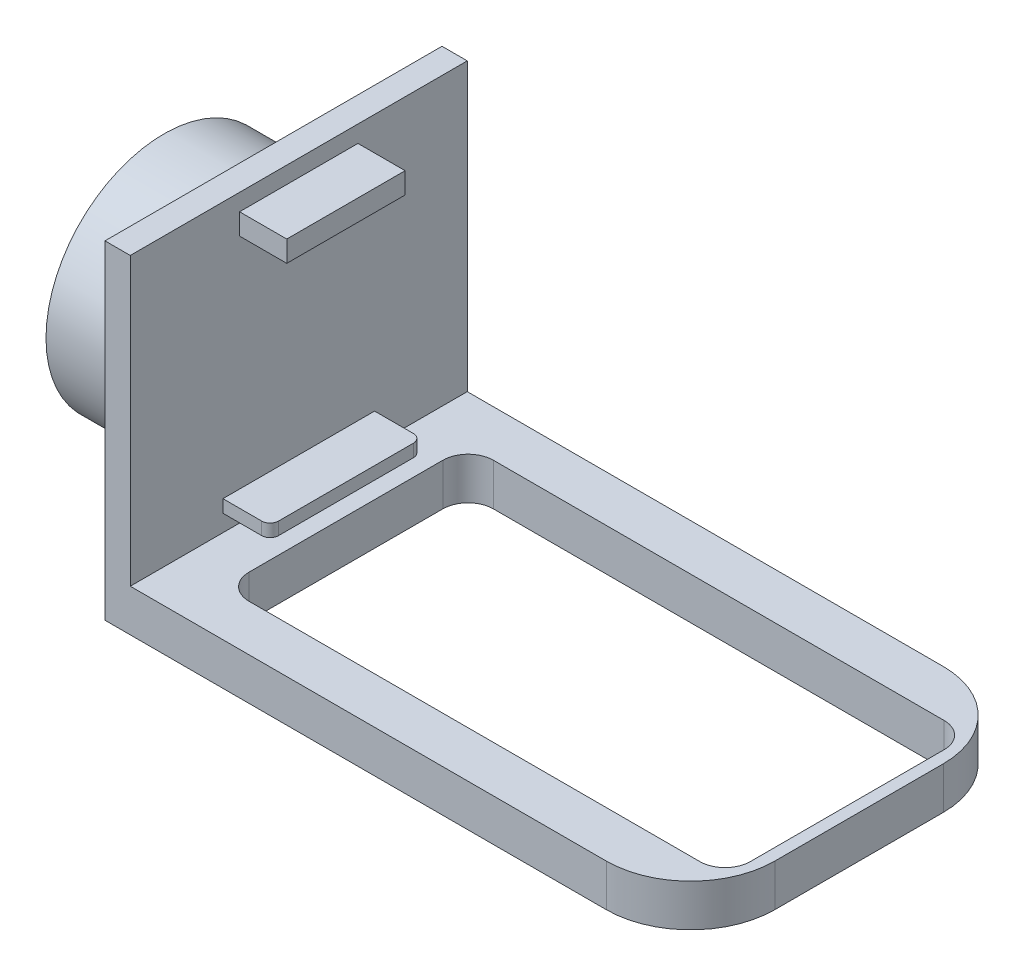
from build123d import *

# Parameters (mm, degrees)
SKETCH2_W           = 66.5
SKETCH2_H           = 40
BOSS_EXTRUDE1_DEPTH = 5
SKETCH5_W           = 40
SKETCH5_H           = 39
BOSS_EXTRUDE3_DEPTH = 3
SKETCH11_W          = 14.05
SKETCH11_H          = 2.5
SKETCH11_W_2        = 18
SKETCH11_H_2        = 1.5
BOSS_EXTRUDE4_DEPTH = 5.6
FILLET4_R           = 1
SKETCH12_R          = 4
BOSS_EXTRUDE5_DEPTH = 3
FILLET6_R           = 10
SKETCH13_R          = 14
BOSS_EXTRUDE6_DEPTH = 10
SKETCH14_R          = 5
CUT_EXTRUDE1_DEPTH  = 5
SKETCH15_R          = 2.25
CUT_EXTRUDE2_DEPTH  = 3


with BuildPart() as part:
    # Sketch2 → Boss-Extrude1 (new body)
    with BuildSketch(Plane(origin=(0, 0, 0), x_dir=(1, 0, 0), z_dir=(0, 1, 0))):
        Rectangle(SKETCH2_W, SKETCH2_H)
        with BuildLine():
            Line((-27.65, 11.5), (-27.65, -11.5))
            ThreePointArc((-27.65, -11.5), (-26.771320344, -13.621320344), (-24.65, -14.5))
            Line((-24.65, -14.5), (28.85, -14.5))
            ThreePointArc((28.85, -14.5), (30.971320344, -13.621320344), (31.85, -11.5))
            Line((31.85, -11.5), (31.85, 11.5))
            ThreePointArc((31.85, 11.5), (30.971320344, 13.621320344), (28.85, 14.5))
            Line((28.85, 14.5), (-24.65, 14.5))
            ThreePointArc((-24.65, 14.5), (-26.771320344, 13.621320344), (-27.65, 11.5))
        make_face(mode=Mode.SUBTRACT)
    extrude(amount=BOSS_EXTRUDE1_DEPTH)

    # Sketch5 → Boss-Extrude3 (add)
    with BuildSketch(Plane.ZY.offset(33.25)):
        with Locations((0, 19.5)):
            Rectangle(SKETCH5_W, SKETCH5_H)
    extrude(amount=BOSS_EXTRUDE3_DEPTH)

    # Sketch11 → Boss-Extrude4 (add)
    with BuildSketch(Plane(origin=(-33.25, 0, 0), x_dir=(0, 0, -1), z_dir=(1, 0, 0))):
        with Locations((0, 35.75)):
            Rectangle(SKETCH11_W, SKETCH11_H)
        with Locations((0, 7.75)):
            Rectangle(SKETCH11_W_2, SKETCH11_H_2)
    extrude(amount=BOSS_EXTRUDE4_DEPTH)

    # Fillet4
    fillet4_edges = [part.edges().sort_by_distance(p)[0] for p in [
        (-27.65, 7.75, -9),
        (-27.65, 7.75, 9),
    ]]
    fillet(fillet4_edges, radius=FILLET4_R)

    # Sketch12 → Boss-Extrude5 (add)
    with BuildSketch(Plane.ZY.offset(36.25)):
        with Locations((0, 19.5)):
            Circle(SKETCH12_R)
    extrude(amount=BOSS_EXTRUDE5_DEPTH)

    # Fillet6
    fillet6_edges = [part.edges().sort_by_distance(p)[0] for p in [
        (33.25, 2.5, 20),
        (33.25, 2.5, -20),
    ]]
    fillet(fillet6_edges, radius=FILLET6_R)

    # Sketch13 → Boss-Extrude6 (add)
    with BuildSketch(Plane.ZY.offset(39.25)):
        with Locations((0, 19.5)):
            Circle(SKETCH13_R)
    extrude(amount=BOSS_EXTRUDE6_DEPTH)

    # Sketch14 → Cut-Extrude1 (cut)
    with BuildSketch(Plane.ZY.offset(49.25)):
        with Locations((0, 19.5)):
            Circle(SKETCH14_R)
    extrude(amount=-CUT_EXTRUDE1_DEPTH, mode=Mode.SUBTRACT)

    # Sketch15 → Cut-Extrude2 (cut)
    with BuildSketch(Plane.ZY.offset(44.25)):
        with Locations((0, 19.5)):
            Circle(SKETCH15_R)
    extrude(amount=-CUT_EXTRUDE2_DEPTH, mode=Mode.SUBTRACT)


solid = part.part
